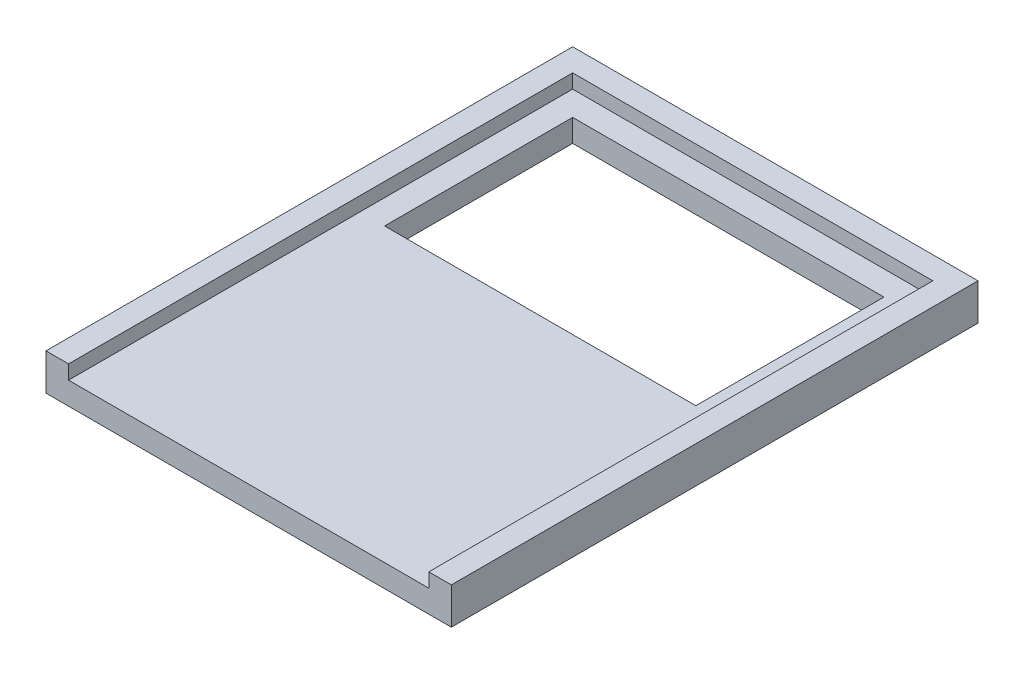
from build123d import *

# Parameters (mm, degrees)
ESQUISSE1_W        = 431
ESQUISSE1_H        = 560
ESQUISSE1_W_2      = 331
ESQUISSE1_H_2      = 200
BOSS_EXTRU_1_DEPTH = 24
BOSS_EXTRU_2_DEPTH = 15


with BuildPart() as part:
    # Esquisse1 → Boss.-Extru.1 (new body)
    with BuildSketch(Plane(origin=(0, 0, 0), x_dir=(1, 0, 0), z_dir=(0, 1, 0))):
        Rectangle(ESQUISSE1_W, ESQUISSE1_H)
        with Locations((0, 130)):
            Rectangle(ESQUISSE1_W_2, ESQUISSE1_H_2, mode=Mode.SUBTRACT)
    extrude(amount=BOSS_EXTRU_1_DEPTH)

    # Esquisse2 → Boss.-Extru.2 (add)
    with BuildSketch(Plane(origin=(0, 24, 0), x_dir=(1, 0, 0), z_dir=(0, 1, 0))):
        Polygon((-215.5, 280), (215.5, 280), (215.5, -280), (191.5, -280), (191.5, 256), (-191.5, 256), (-191.5, -280), (-215.5, -280), align=None)
    extrude(amount=BOSS_EXTRU_2_DEPTH)


solid = part.part
